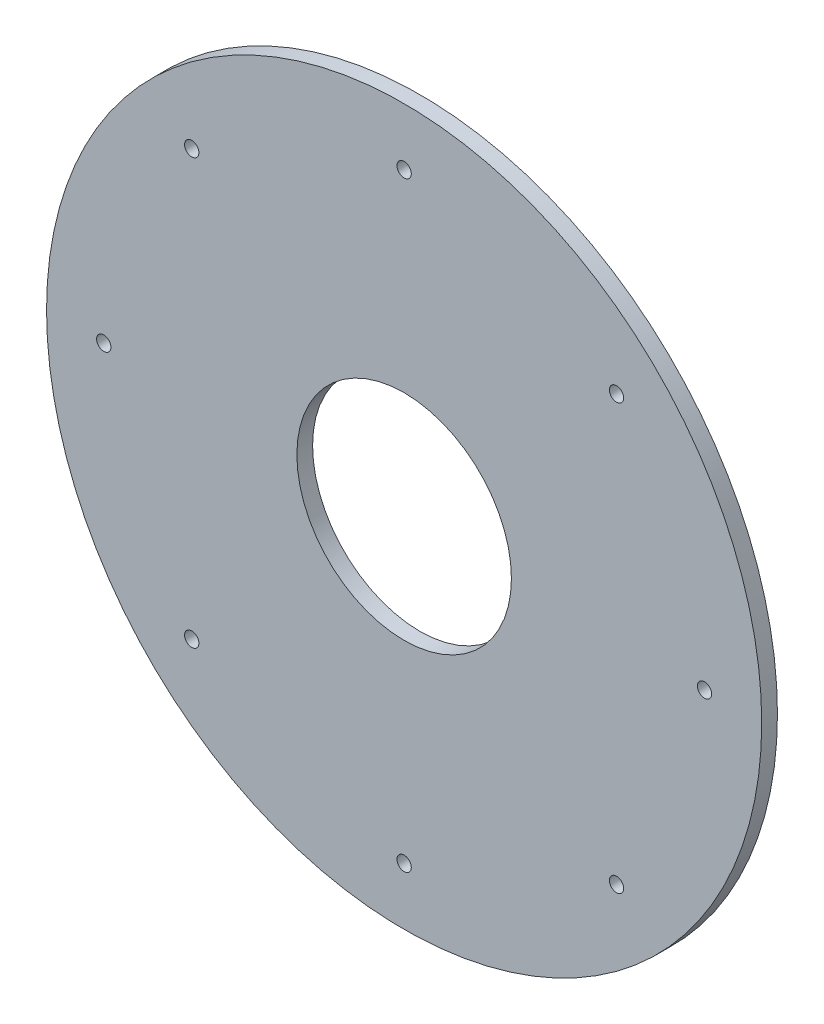
from build123d import *

# Parameters (mm, degrees)
SKETCH2_R           = 250
SKETCH2_R_2         = 75
BOSS_EXTRUDE1_DEPTH = 11
SKETCH3_R           = 5
CUT_EXTRUDE1_DEPTH  = 354.724469043


with BuildPart() as part:
    # Sketch2 → Boss-Extrude1 (new body)
    with BuildSketch(Plane.XY):
        Circle(SKETCH2_R)
        Circle(SKETCH2_R_2, mode=Mode.SUBTRACT)
    extrude(amount=BOSS_EXTRUDE1_DEPTH)

    # Sketch3 → Cut-Extrude1 (cut, through all)
    with BuildSketch(Plane.XY.offset(11)):
        with Locations((0, 210)):
            Circle(SKETCH3_R)
        with Locations((148.492424049, 148.492424049)):
            Circle(SKETCH3_R)
        with Locations((210, 0)):
            Circle(SKETCH3_R)
        with Locations((148.492424049, -148.492424049)):
            Circle(SKETCH3_R)
        with Locations((0, -210)):
            Circle(SKETCH3_R)
        with Locations((-148.492424049, -148.492424049)):
            Circle(SKETCH3_R)
        with Locations((-210, 0)):
            Circle(SKETCH3_R)
        with Locations((-148.492424049, 148.492424049)):
            Circle(SKETCH3_R)
    extrude(amount=-CUT_EXTRUDE1_DEPTH, mode=Mode.SUBTRACT)


solid = part.part
